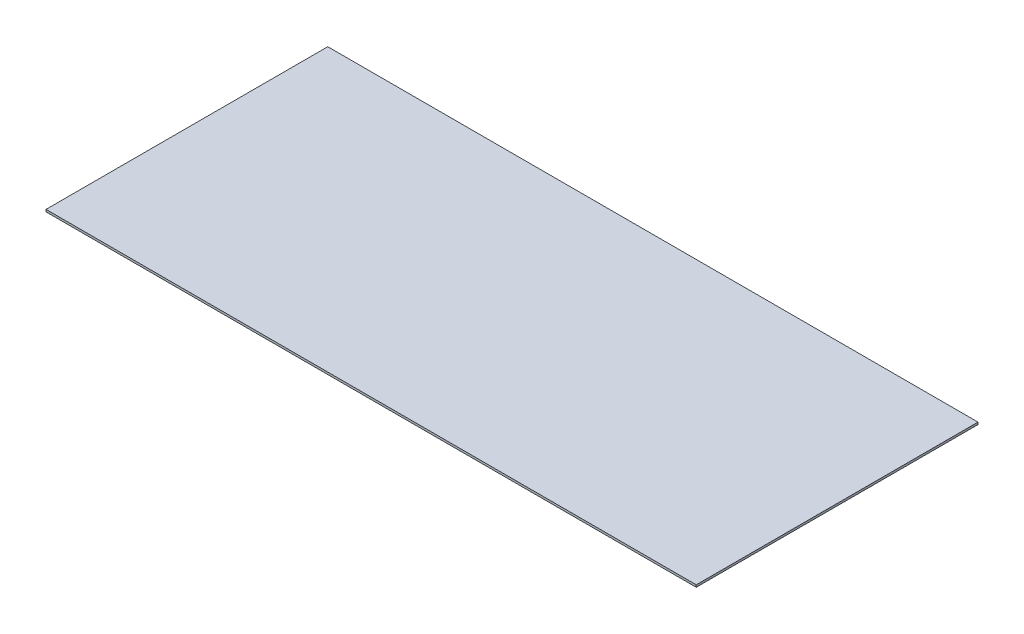
from build123d import *

# Parameters (mm, degrees)
SKETCH_1_W      = 600
SKETCH_1_H      = 260
EXTRUDE_1_DEPTH = 2


with BuildPart() as part:
    # Эскиз1 → Бобышка-Вытянуть1 (new body)
    with BuildSketch(Plane(origin=(0, 0, 0), x_dir=(1, 0, 0), z_dir=(0, 1, 0))):
        with Locations((0, 5)):
            Rectangle(SKETCH_1_W, SKETCH_1_H)
    extrude(amount=EXTRUDE_1_DEPTH)


solid = part.part
